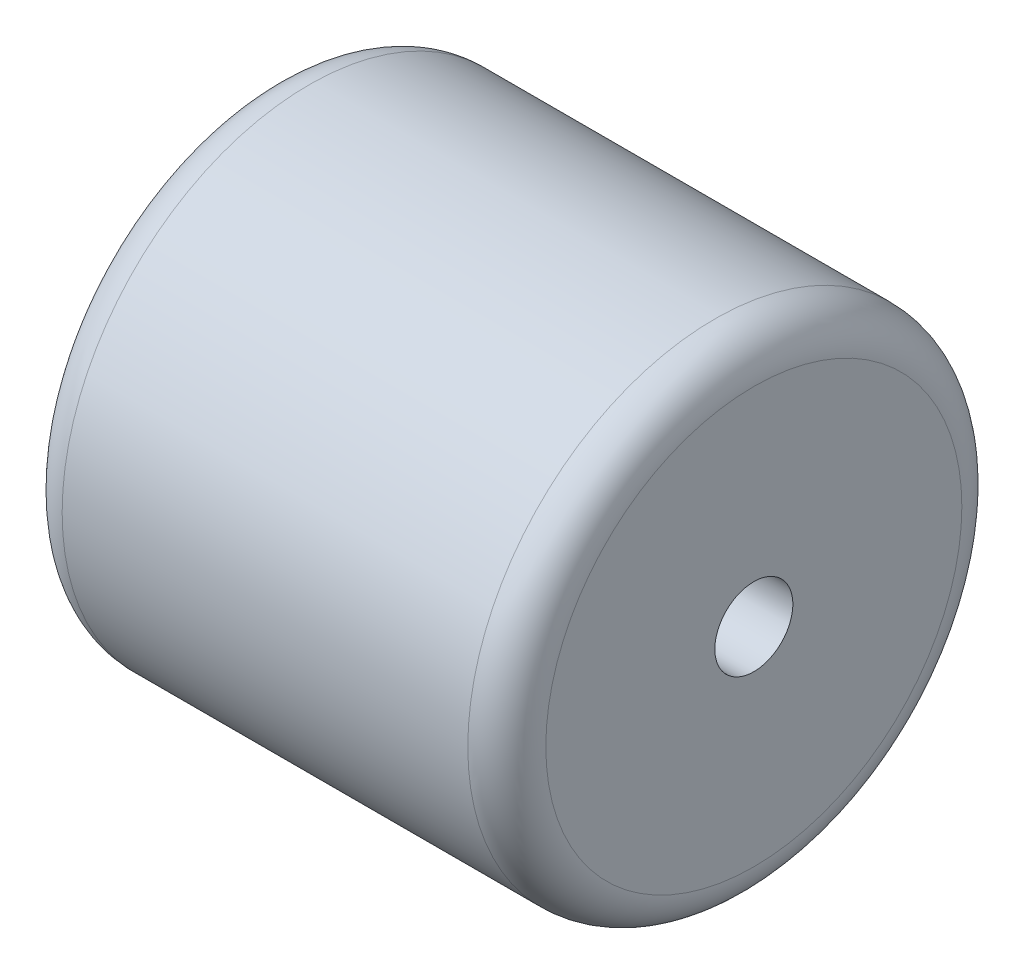
from build123d import *


with BuildPart() as part:
    # Sketch1 → Revolve1 (revolve)
    with BuildSketch(Plane.XY, mode=Mode.PRIVATE) as revolve1_sk:
        with BuildLine():
            Line((-9.3, 1.5), (9.3, 1.5))
            Line((9.3, 1.5), (9.3, 8))
            ThreePointArc((9.3, 8), (8.860660172, 9.060660172), (7.8, 9.5))
            Line((7.8, 9.5), (-7.8, 9.5))
            ThreePointArc((-7.8, 9.5), (-8.860660172, 9.060660172), (-9.3, 8))
            Line((-9.3, 8), (-9.3, 1.5))
        make_face()
    revolve(revolve1_sk.sketch.rotate(Axis((-3.872802753, 0, 0), (1, 0, 0)), 90), axis=Axis((-3.872802753, 0, 0), (1, 0, 0)))


solid = part.part
